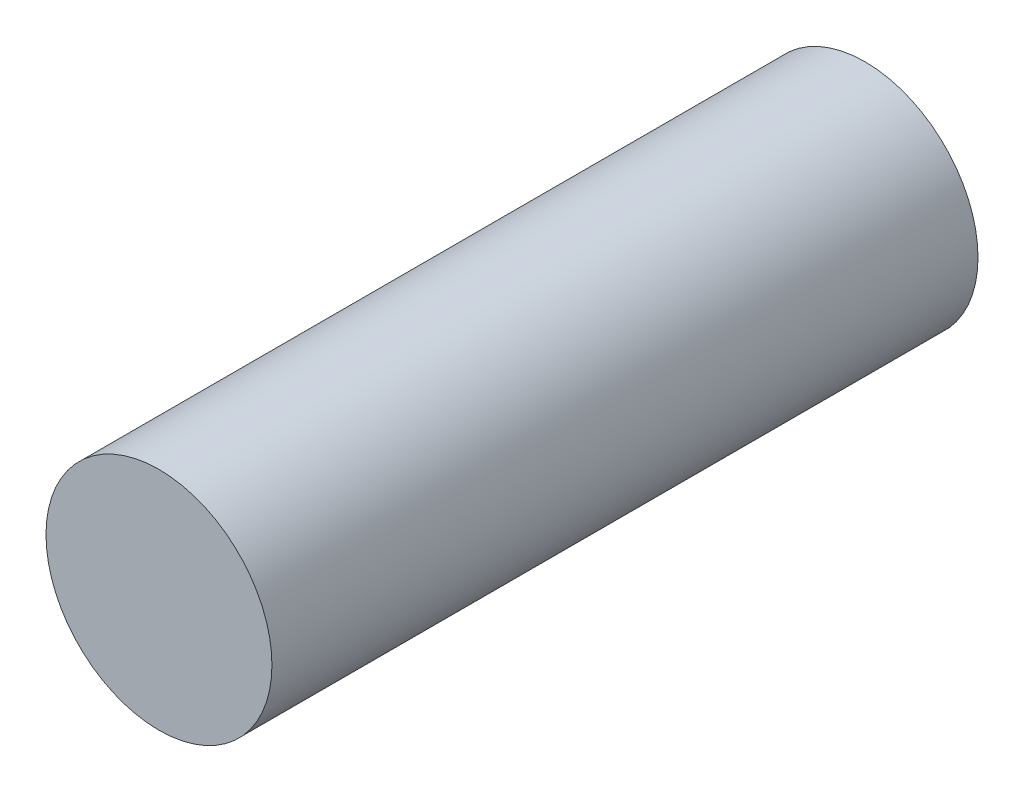
from build123d import *

# Parameters (mm, degrees)
ESBO_O1_R                = 4
RESSALTO_EXTRUS_O1_DEPTH = 12.5


with BuildPart() as part:
    # Esboço1 → Ressalto-extrusão1 (new, symmetric)
    with BuildSketch(Plane.XY):
        Circle(ESBO_O1_R)
    extrude(amount=RESSALTO_EXTRUS_O1_DEPTH, both=True)


solid = part.part
